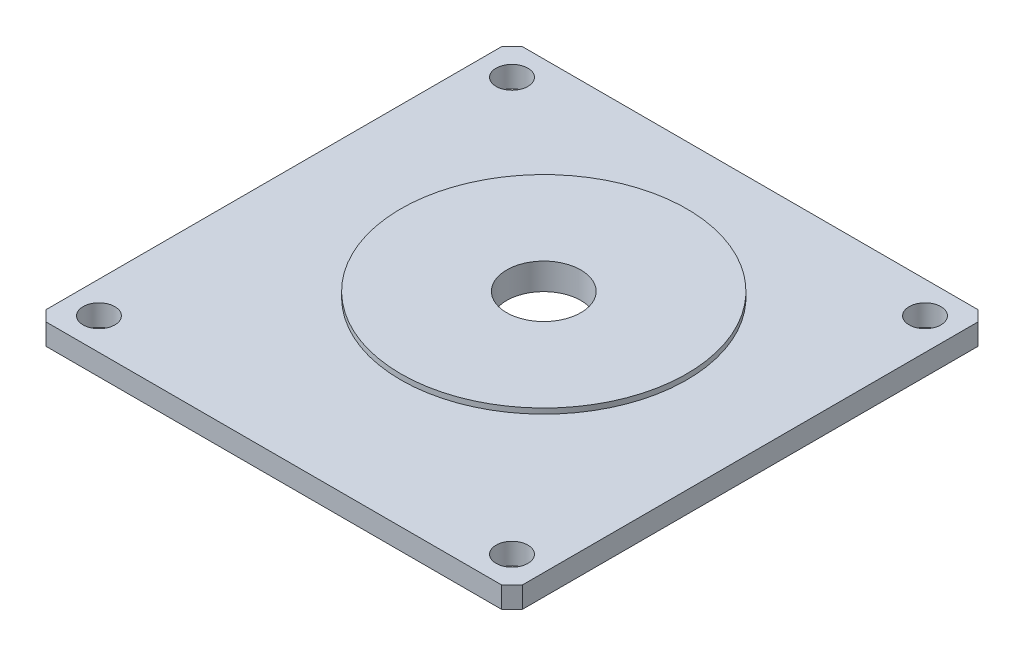
from build123d import *

# Parameters (mm, degrees)
SKETCH_1_W          = 45
SKETCH_1_H          = 45
EXTRUDE_1_DEPTH     = 2
SKETCH_2_R          = 3.5
CUT_EXTRUDE_1_DEPTH = 32.882597134
EXTRUDE_START       = 0.5
SKETCH_3_R          = 13.5
SKETCH_3_R_2        = 3.5
EXTRUDE_2_DEPTH     = 0.5
SKETCH_4_R          = 1.5
CUT_EXTRUDE_4_DEPTH = 32.917863337
CHAMFER_1_SIZE      = 1


with BuildPart() as part:
    # 草图1 → 凸台-拉伸1 (new body)
    with BuildSketch(Plane(origin=(0, 0, 0), x_dir=(1, 0, 0), z_dir=(0, 1, 0))):
        Rectangle(SKETCH_1_W, SKETCH_1_H)
    extrude(amount=EXTRUDE_1_DEPTH)

    # 草图2 → 切除-拉伸1 (cut, through all)
    with BuildSketch(Plane(origin=(0, 2, 0), x_dir=(1, 0, 0), z_dir=(0, 1, 0))):
        with Locations(Location((0, 3, 0), (0, 0, 270))):
            Circle(SKETCH_2_R)
    extrude(amount=-CUT_EXTRUDE_1_DEPTH, mode=Mode.SUBTRACT)

    # 草图3 → 凸台-拉伸2 (add)
    with BuildSketch(Plane(origin=(0, 2, 0), x_dir=(1, 0, 0), z_dir=(0, 1, 0)).offset(EXTRUDE_START)):
        with Locations(Location((0, 3, 0), (0, 0, 270))):
            Circle(SKETCH_3_R)
        with Locations(Location((0, 3, 0), (0, 0, 270))):
            Circle(SKETCH_3_R_2, mode=Mode.SUBTRACT)
    extrude(amount=-EXTRUDE_2_DEPTH)

    # 草图4 → 切除-拉伸4 (cut, through all)
    with BuildSketch(Plane(origin=(0, 0, 0), x_dir=(1, 0, 0), z_dir=(0, 1, 0))):
        with Locations(Location((19.5, 19.5, 0), (0, 0, 90))):
            Circle(SKETCH_4_R)
        with Locations(Location((-19.5, 19.5, 0), (0, 0, 90))):
            Circle(SKETCH_4_R)
        with Locations(Location((-19.5, -19.5, 0), (0, 0, 90))):
            Circle(SKETCH_4_R)
        with Locations(Location((19.5, -19.5, 0), (0, 0, 90))):
            Circle(SKETCH_4_R)
    extrude(amount=CUT_EXTRUDE_4_DEPTH, mode=Mode.SUBTRACT)

    # 倒角1
    chamfer_1_edges = [part.edges().sort_by_distance(p)[0] for p in [
        (22.5, 1, 22.5),
        (-22.5, 1, 22.5),
        (-22.5, 1, -22.5),
        (22.5, 1, -22.5),
    ]]
    chamfer(chamfer_1_edges, length=CHAMFER_1_SIZE)


solid = part.part
